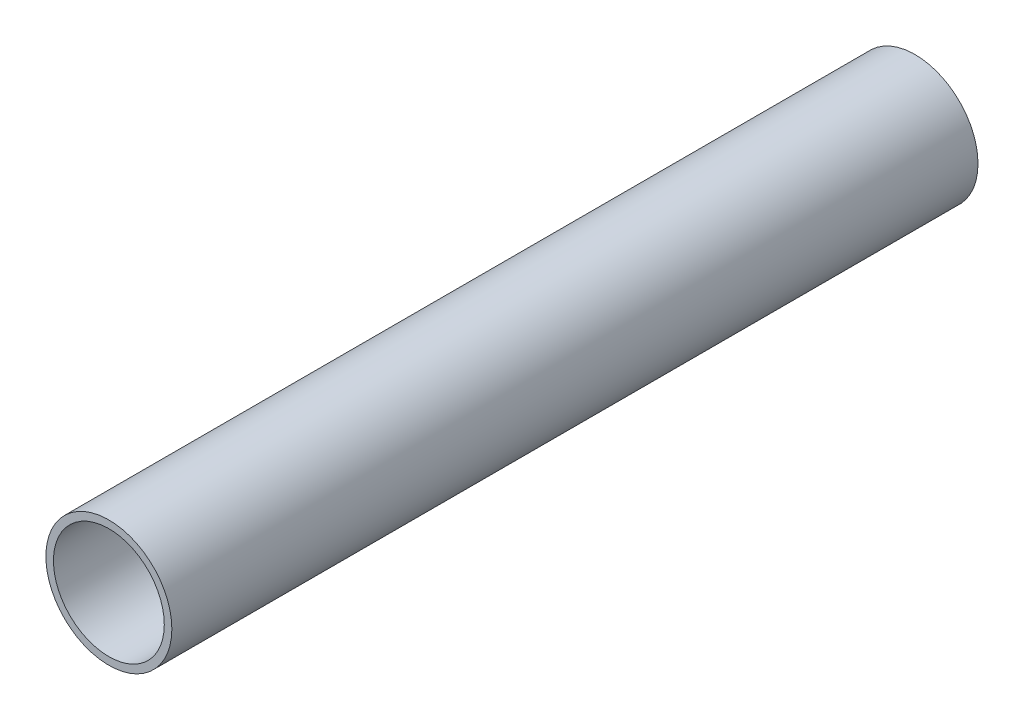
from build123d import *

# Parameters (mm, degrees)
SKETCH5_R           = 63.504203269
SKETCH5_R_2         = 55.88
BOSS_EXTRUDE1_DEPTH = 812.8


with BuildPart() as part:
    # Sketch5 → Boss-Extrude1 (new body)
    with BuildSketch(Plane.XY):
        Circle(SKETCH5_R)
        Circle(SKETCH5_R_2, mode=Mode.SUBTRACT)
    extrude(amount=BOSS_EXTRUDE1_DEPTH)


solid = part.part
